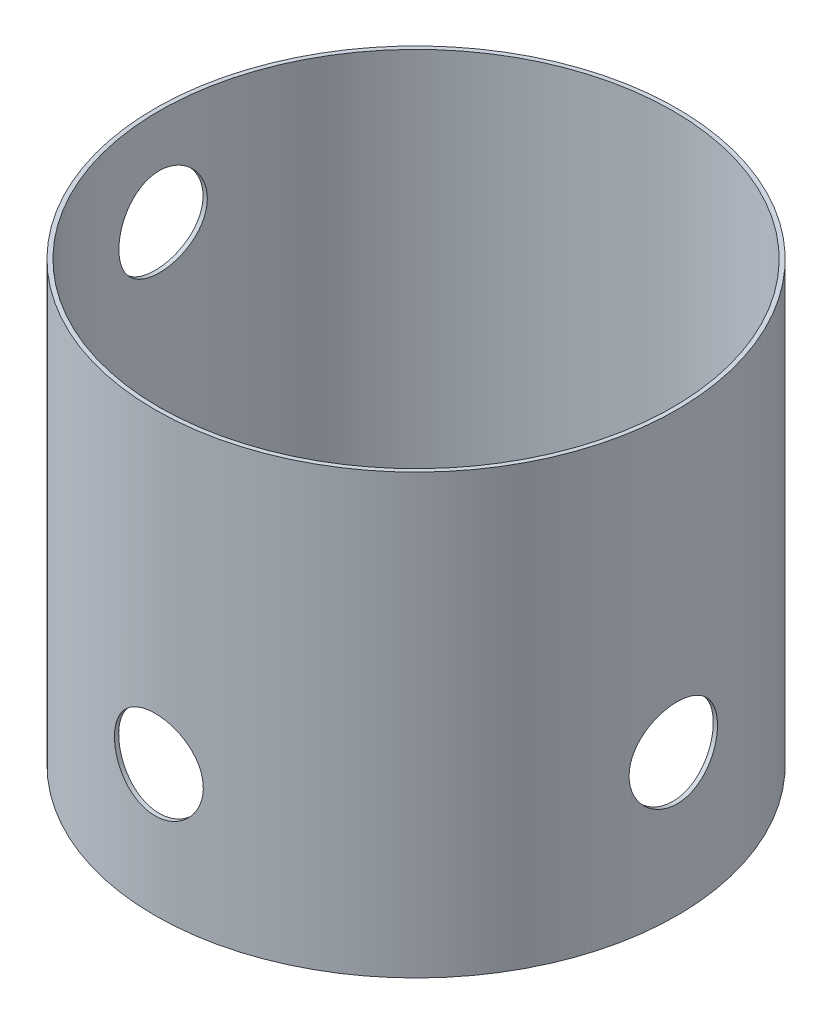
from build123d import *

# Parameters (mm, degrees)
SKETCH2_R           = 62.854
SKETCH2_R_2         = 61.838
BOSS_EXTRUDE1_DEPTH = 105.5
SKETCH3_R           = 10.7
CUT_EXTRUDE1_DEPTH  = 105.5
SKETCH4_R           = 10.65
CUT_EXTRUDE2_DEPTH  = 105.5
SKETCH5_R           = 10.65
CUT_EXTRUDE3_DEPTH  = 105.5


with BuildPart() as part:
    # Sketch2 → Boss-Extrude1 (new body)
    with BuildSketch(Plane(origin=(0, 0, 0), x_dir=(-1, 0, 0), z_dir=(0, 1, 0))):
        with Locations(Location((4.078625789, 4.753613482, 0), (0, 0, 270))):
            Circle(SKETCH2_R)
        with Locations(Location((4.078625789, 4.753613482, 0), (0, 0, 270))):
            Circle(SKETCH2_R_2, mode=Mode.SUBTRACT)
    extrude(amount=BOSS_EXTRUDE1_DEPTH)

    # Sketch3 → Cut-Extrude1 (cut)
    with BuildSketch(Plane(origin=(-8.080908151, 23.599932993, 4.753613482), x_dir=(-1, 0, 0), z_dir=(0, 0, -1))):
        with Locations(Location((-4.002282363, 7.900067007, 0), (0, 0, 90))):
            Circle(SKETCH3_R)
    extrude(amount=-CUT_EXTRUDE1_DEPTH, mode=Mode.SUBTRACT)

    # Sketch4 → Cut-Extrude2 (cut)
    with BuildSketch(Plane(origin=(-4.078625789, 23.599932993, 9.571680039), x_dir=(0, 0, -1), z_dir=(1, 0, 0))):
        with Locations(Location((4.818066557, 10.350067007, 0), (0, 0, 270))):
            Circle(SKETCH4_R)
    extrude(amount=CUT_EXTRUDE2_DEPTH, mode=Mode.SUBTRACT)

    # Sketch5 → Cut-Extrude3 (cut)
    with BuildSketch(Plane(origin=(-4.078625789, 23.599932993, 9.571680039), x_dir=(0, 0, -1), z_dir=(1, 0, 0))):
        with Locations(Location((4.818066557, 58.750067007, 0), (0, 0, 90))):
            Circle(SKETCH5_R)
    extrude(amount=-CUT_EXTRUDE3_DEPTH, mode=Mode.SUBTRACT)


solid = part.part
